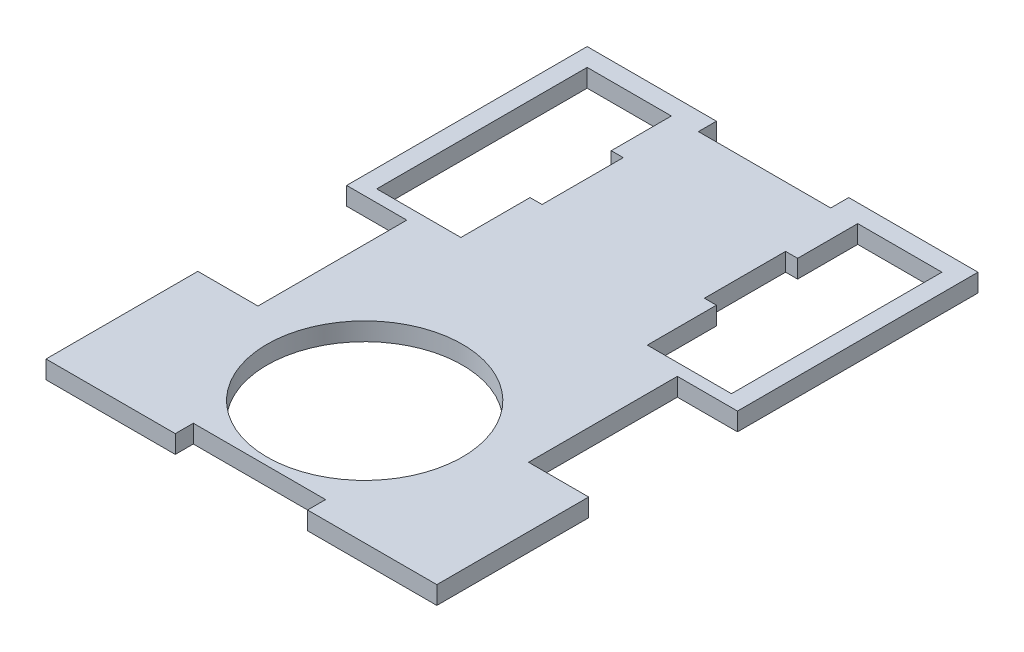
from build123d import *

# Parameters (mm, degrees)
SKETCH1_W           = 130
SKETCH1_H           = 180
BOSS_EXTRUDE1_DEPTH = 6
SKETCH2_R           = 32.5
SKETCH2_W           = 28
SKETCH2_H           = 70
CUT_EXTRUDE2_DEPTH  = 6
SKETCH3_W           = 20
SKETCH3_H           = 49.5
CUT_EXTRUDE3_DEPTH  = 223.117086241
SKETCH4_W           = 44
SKETCH4_H           = 6
SKETCH4_W_2         = 4
SKETCH4_H_2         = 27
CUT_EXTRUDE4_DEPTH  = 223.117086241


with BuildPart() as part:
    # Sketch1 → Boss-Extrude1 (new body)
    with BuildSketch(Plane(origin=(0, 0, 0), x_dir=(1, 0, 0), z_dir=(0, 1, 0))):
        with Locations((65, 90)):
            Rectangle(SKETCH1_W, SKETCH1_H)
    extrude(amount=BOSS_EXTRUDE1_DEPTH)

    # Sketch2 → Cut-Extrude2 (cut)
    with BuildSketch(Plane(origin=(0, 6, 0), x_dir=(1, 0, 0), z_dir=(0, 1, 0))):
        with Locations(Location((65, 41, 0), (0, 0, 270))):
            Circle(SKETCH2_R)
        with Locations((20, 139)):
            Rectangle(SKETCH2_W, SKETCH2_H)
        with Locations((110, 139)):
            Rectangle(SKETCH2_W, SKETCH2_H)
    extrude(amount=-CUT_EXTRUDE2_DEPTH, mode=Mode.SUBTRACT)

    # Sketch3 → Cut-Extrude3 (cut, through all)
    with BuildSketch(Plane(origin=(0, 6, 0), x_dir=(1, 0, 0), z_dir=(0, 1, 0))):
        with Locations((120, 75.25)):
            Rectangle(SKETCH3_W, SKETCH3_H)
        with Locations((10, 75.25)):
            Rectangle(SKETCH3_W, SKETCH3_H)
    extrude(amount=-CUT_EXTRUDE3_DEPTH, mode=Mode.SUBTRACT)

    # Sketch4 → Cut-Extrude4 (cut, through all)
    with BuildSketch(Plane(origin=(0, 6, 0), x_dir=(1, 0, 0), z_dir=(0, 1, 0))):
        with Locations((65, 177)):
            Rectangle(SKETCH4_W, SKETCH4_H)
        with Locations((36, 140.5)):
            Rectangle(SKETCH4_W_2, SKETCH4_H_2)
        with Locations((94, 140.5)):
            Rectangle(SKETCH4_W_2, SKETCH4_H_2)
        with Locations((65, 3)):
            Rectangle(SKETCH4_W, SKETCH4_H)
    extrude(amount=-CUT_EXTRUDE4_DEPTH, mode=Mode.SUBTRACT)


solid = part.part
